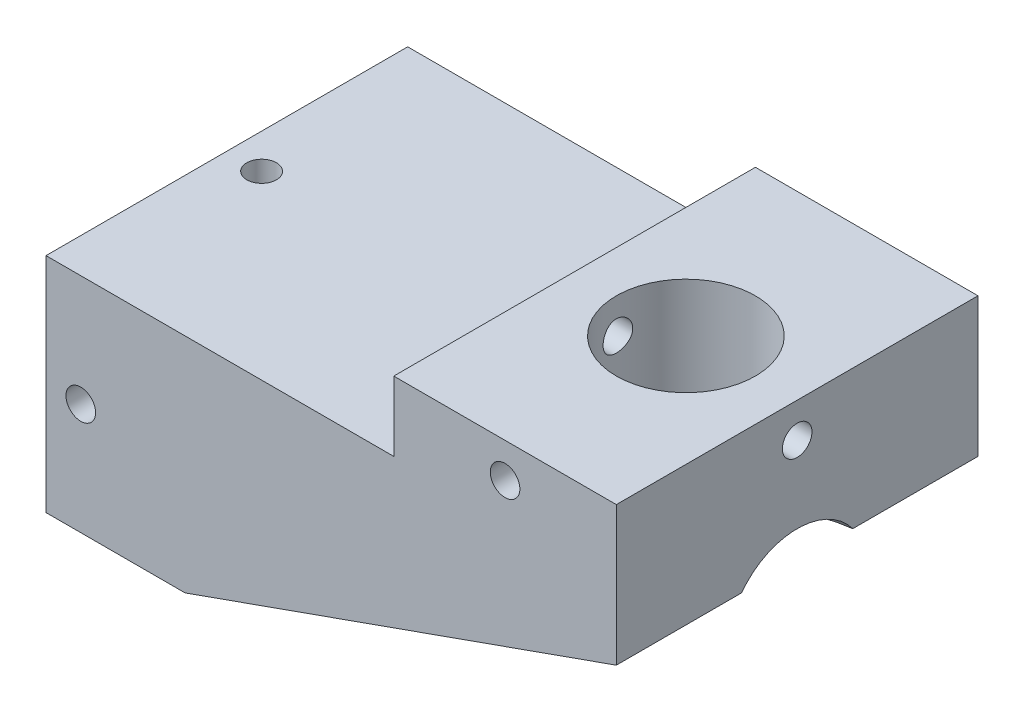
from build123d import *

# Parameters (mm, degrees)
SKETCH1_W           = 33.02
SKETCH1_H           = 20.32
BOSS_EXTRUDE1_DEPTH = 6.35
SKETCH2_W           = 20.32
SKETCH2_H           = 33.02
BOSS_EXTRUDE2_DEPTH = 6.35
BOSS_EXTRUDE3_DEPTH = 33.02
SKETCH6_R           = 6.35
CUT_EXTRUDE1_DEPTH  = 61.787777554
SKETCH7_R           = 6.35
CUT_EXTRUDE2_DEPTH  = 58.065270644


with BuildPart() as part:
    # Sketch1 → Boss-Extrude1 (new body)
    with BuildSketch(Plane(origin=(0, 0, 0), x_dir=(0, 0, -1), z_dir=(1, 0, 0))):
        Rectangle(SKETCH1_W, SKETCH1_H)
    extrude(amount=BOSS_EXTRUDE1_DEPTH)

    # Sketch5 → #6-32 Tapped Hole1 (revolve, cut)
    with BuildSketch(Plane(origin=(3.175, 0, -16.51), x_dir=(0, 1, 0), z_dir=(1, 0, 0))):
        Polygon((0, 0), (0, 9.44869403), (1.35255, 8.636), (1.35255, 0), align=None)
    revolve(axis=Axis((3.175, 0, -22.86), (0, 0, 1)), mode=Mode.SUBTRACT)

    # Sketch5 at point 2 (carried to point 2, square into its face) → #6-32 Tapped Hole1 at 2 (revolve, cut)
    with BuildSketch(Plane(origin=(3.175, 10.16, 0), x_dir=(0, 0, 1), z_dir=(1, 0, 0))):
        Polygon((0, 0), (0, 9.44869403), (1.35255, 8.636), (1.35255, 0), align=None)
    revolve(axis=Axis((3.175, 16.51, 0), (0, -1, 0)), mode=Mode.SUBTRACT)

    # Sketch5 at point 7 (carried to point 7, square into its face) → #6-32 Tapped Hole1 at 7 (revolve, cut)
    with BuildSketch(Plane(origin=(3.175, 0, 16.51), x_dir=(0, 1, 0), z_dir=(-1, 0, 0))):
        Polygon((0, 0), (0, 9.44869403), (1.35255, 8.636), (1.35255, 0), align=None)
    revolve(axis=Axis((3.175, 0, 22.86), (0, 0, -1)), mode=Mode.SUBTRACT)

    # Sketch5 at point 8 (carried to point 8, square into its face) → #6-32 Tapped Hole1 at 8 (revolve, cut)
    with BuildSketch(Plane(origin=(3.175, -10.16, 0), x_dir=(0, 0, -1), z_dir=(1, 0, 0))):
        Polygon((0, 0), (0, 9.44869403), (1.35255, 8.636), (1.35255, 0), align=None)
    revolve(axis=Axis((3.175, -16.51, 0), (0, 1, 0)), mode=Mode.SUBTRACT)



with BuildPart() as body_2:
    # Sketch2 → Boss-Extrude2 (new body)
    with BuildSketch(Plane(origin=(0, 10.16, 0), x_dir=(1, 0, 0), z_dir=(0, 1, 0))):
        with Locations((41.91, 0)):
            Rectangle(SKETCH2_W, SKETCH2_H)
    extrude(amount=BOSS_EXTRUDE2_DEPTH)

    # Sketch5 at point 3 (carried to point 3, square into its face) → #6-32 Tapped Hole1 at 3 (revolve, cut)
    with BuildSketch(Plane(origin=(31.75, 13.335, 0), x_dir=(0, 1, 0), z_dir=(0, 0, -1))):
        Polygon((0, 0), (0, 9.44869403), (1.35255, 8.636), (1.35255, 0), align=None)
    revolve(axis=Axis((25.4, 13.335, 0), (1, 0, 0)), mode=Mode.SUBTRACT)

    # Sketch5 at point 4 (carried to point 4, square into its face) → #6-32 Tapped Hole1 at 4 (revolve, cut)
    with BuildSketch(Plane(origin=(41.91, 13.335, -16.51), x_dir=(0, 1, 0), z_dir=(1, 0, 0))):
        Polygon((0, 0), (0, 9.44869403), (1.35255, 8.636), (1.35255, 0), align=None)
    revolve(axis=Axis((41.91, 13.335, -22.86), (0, 0, 1)), mode=Mode.SUBTRACT)

    # Sketch5 at point 5 (carried to point 5, square into its face) → #6-32 Tapped Hole1 at 5 (revolve, cut)
    with BuildSketch(Plane(origin=(41.91, 13.335, 16.51), x_dir=(0, 1, 0), z_dir=(-1, 0, 0))):
        Polygon((0, 0), (0, 9.44869403), (1.35255, 8.636), (1.35255, 0), align=None)
    revolve(axis=Axis((41.91, 13.335, 22.86), (0, 0, -1)), mode=Mode.SUBTRACT)

    # Sketch5 at point 6 (carried to point 6, square into its face) → #6-32 Tapped Hole1 at 6 (revolve, cut)
    with BuildSketch(Plane(origin=(52.07, 13.335, 0), x_dir=(0, 1, 0), z_dir=(0, 0, 1))):
        Polygon((0, 0), (0, 9.44869403), (1.35255, 8.636), (1.35255, 0), align=None)
    revolve(axis=Axis((58.42, 13.335, 0), (-1, 0, 0)), mode=Mode.SUBTRACT)


with BuildPart() as part_1:
    add(part.part)

    add(body_2.part)  # Boss-Extrude3 merges body 2
    # Sketch4 → Boss-Extrude3 (add, through all)
    with BuildSketch(Plane.XY.offset(-16.51)):
        Polygon((52.07, 10.16), (52.07, 3.81), (12.7, -10.16), (6.35, -10.16), (6.35, 10.16), align=None)
    extrude(amount=BOSS_EXTRUDE3_DEPTH)

    # Sketch6 → Cut-Extrude1 (cut, through all)
    with BuildSketch(Plane(origin=(0, 16.51, 0), x_dir=(1, 0, 0), z_dir=(0, 1, 0))):
        with Locations(Location((41.91, 0, 0), (0, 0, 270))):
            Circle(SKETCH6_R)
    extrude(amount=-CUT_EXTRUDE1_DEPTH, mode=Mode.SUBTRACT)

    # Sketch7 → Cut-Extrude2 (cut, through all)
    with BuildSketch(Plane.ZY):
        Circle(SKETCH7_R)
    extrude(amount=-CUT_EXTRUDE2_DEPTH, mode=Mode.SUBTRACT)


solid = part_1.part
